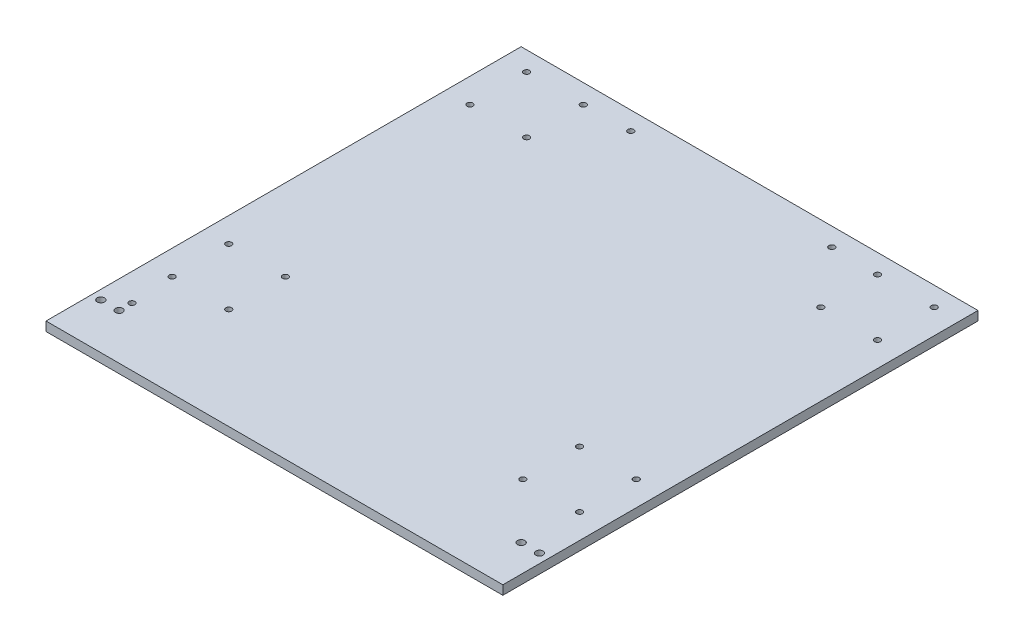
from build123d import *

# Parameters (mm, degrees)
SKETCH_1_W      = 250
SKETCH_1_H      = 260
SKETCH_1_R      = 1.6
SKETCH_1_R_2    = 2
EXTRUDE_1_DEPTH = 5


with BuildPart() as part:
    # 草图1 → 凸台-拉伸1 (new body)
    with BuildSketch(Plane(origin=(0, 0, 0), x_dir=(1, 0, 0), z_dir=(0, 1, 0))):
        Rectangle(SKETCH_1_W, SKETCH_1_H)
        with Locations(Location((-111.5, 119.5, 0), (0, 0, 270))):
            Circle(SKETCH_1_R, mode=Mode.SUBTRACT)
        with Locations(Location((-80.5, 119.5, 0), (0, 0, 270))):
            Circle(SKETCH_1_R, mode=Mode.SUBTRACT)
        with Locations(Location((-80.5, 88.5, 0), (0, 0, 270))):
            Circle(SKETCH_1_R, mode=Mode.SUBTRACT)
        with Locations(Location((-111.5, 88.5, 0), (0, 0, 270))):
            Circle(SKETCH_1_R, mode=Mode.SUBTRACT)
        with Locations(Location((-111.5, -43.5, 0), (0, 0, 270))):
            Circle(SKETCH_1_R, mode=Mode.SUBTRACT)
        with Locations(Location((-80.5, -43.5, 0), (0, 0, 270))):
            Circle(SKETCH_1_R, mode=Mode.SUBTRACT)
        with Locations(Location((-80.5, -74.5, 0), (0, 0, 270))):
            Circle(SKETCH_1_R, mode=Mode.SUBTRACT)
        with Locations(Location((-111.5, -74.5, 0), (0, 0, 270))):
            Circle(SKETCH_1_R, mode=Mode.SUBTRACT)
        with Locations(Location((111.5, -74.5, 0), (0, 0, 90))):
            Circle(SKETCH_1_R, mode=Mode.SUBTRACT)
        with Locations(Location((80.5, -74.5, 0), (0, 0, 90))):
            Circle(SKETCH_1_R, mode=Mode.SUBTRACT)
        with Locations(Location((80.5, -43.5, 0), (0, 0, 90))):
            Circle(SKETCH_1_R, mode=Mode.SUBTRACT)
        with Locations(Location((111.5, -43.5, 0), (0, 0, 90))):
            Circle(SKETCH_1_R, mode=Mode.SUBTRACT)
        with Locations(Location((111.5, 88.5, 0), (0, 0, 90))):
            Circle(SKETCH_1_R, mode=Mode.SUBTRACT)
        with Locations(Location((80.5, 88.5, 0), (0, 0, 90))):
            Circle(SKETCH_1_R, mode=Mode.SUBTRACT)
        with Locations(Location((80.5, 119.5, 0), (0, 0, 90))):
            Circle(SKETCH_1_R, mode=Mode.SUBTRACT)
        with Locations(Location((111.5, 119.5, 0), (0, 0, 90))):
            Circle(SKETCH_1_R, mode=Mode.SUBTRACT)
        with Locations(Location((-120, -105, 0), (0, 0, 270))):
            Circle(SKETCH_1_R_2, mode=Mode.SUBTRACT)
        with Locations(Location((-110, -105, 0), (0, 0, 270))):
            Circle(SKETCH_1_R_2, mode=Mode.SUBTRACT)
        with Locations(Location((110, -105, 0), (0, 0, 90))):
            Circle(SKETCH_1_R_2, mode=Mode.SUBTRACT)
        with Locations(Location((120, -105, 0), (0, 0, 90))):
            Circle(SKETCH_1_R_2, mode=Mode.SUBTRACT)
        with Locations(Location((-55, 120, 0), (0, 0, 270))):
            Circle(SKETCH_1_R, mode=Mode.SUBTRACT)
        with Locations(Location((55, 120, 0), (0, 0, 90))):
            Circle(SKETCH_1_R, mode=Mode.SUBTRACT)
        with Locations(Location((-110, -98, 0), (0, 0, 270))):
            Circle(SKETCH_1_R, mode=Mode.SUBTRACT)
    extrude(amount=EXTRUDE_1_DEPTH)


solid = part.part
